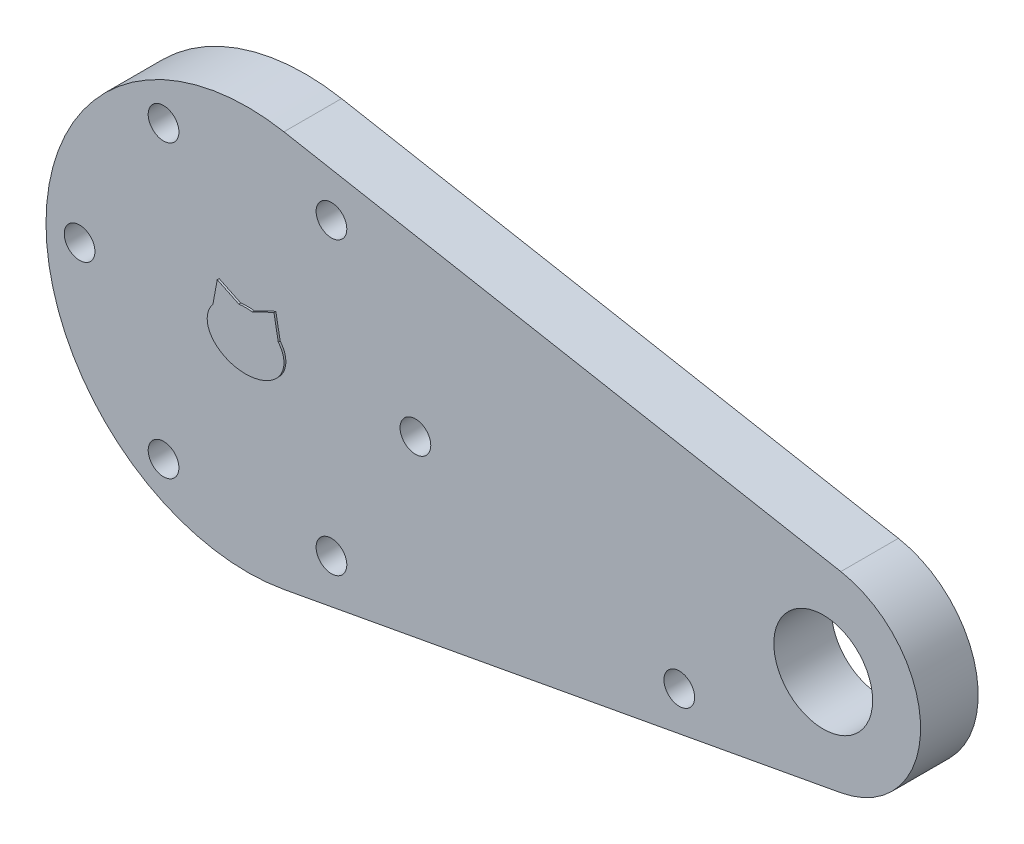
from build123d import *

# Parameters (mm, degrees)
SKETCH_1_R          = 5.15
EXTRUDE_1_DEPTH     = 6
SKETCH_3_R          = 1.6
CUT_EXTRUDE_2_DEPTH = 74.471235868
SKETCH_5_R          = 13.5
EXTRUDE_3_DEPTH     = 0.5
SKETCH_4_R          = 12.35
SKETCH_4_R_2        = 7.65
EXTRUDE_2_DEPTH     = 4
SKETCH_6_R          = 3
CUT_EXTRUDE_3_DEPTH = 3
SKETCH_7_R          = 2.85
CUT_EXTRUDE_4_DEPTH = 3
EXTRUDE_4_DEPTH     = 0.2
SKETCH_10_R         = 1.6
CUT_EXTRUDE_6_DEPTH = 74.487839262


with BuildPart() as part:
    # 草图1 → 凸台-拉伸1 (new body)
    with BuildSketch(Plane.XY):
        with BuildLine():
            Line((61.835458333, -9.98266461), (3.7975, -20.653788847))
            ThreePointArc((3.7975, -20.653788847), (-21, 0), (3.7975, 20.653788847))
            Line((3.7975, 20.653788847), (61.835458333, 9.98266461))
            ThreePointArc((61.835458333, 9.98266461), (70.15, 0), (61.835458333, -9.98266461))
        make_face()
        with Locations((60, 0)):
            Circle(SKETCH_1_R, mode=Mode.SUBTRACT)
    extrude(amount=EXTRUDE_1_DEPTH)

    # 草图3 → 切除-拉伸2 (cut, through all)
    with BuildSketch(Plane.XY.offset(6)):
        with Locations((8.75, 15.155444566)):
            Circle(SKETCH_3_R)
        with Locations((17.5, 0)):
            Circle(SKETCH_3_R)
        with Locations((8.75, -15.155444566)):
            Circle(SKETCH_3_R)
        with Locations((-8.75, -15.155444566)):
            Circle(SKETCH_3_R)
        with Locations((-17.5, 0)):
            Circle(SKETCH_3_R)
        with Locations((-8.75, 15.155444566)):
            Circle(SKETCH_3_R)
    extrude(amount=-CUT_EXTRUDE_2_DEPTH, mode=Mode.SUBTRACT)

    # 草图5 → 凸台-拉伸3 (add)
    with BuildSketch(Plane(origin=(0, 0, 0), x_dir=(-1, 0, 0), z_dir=(0, 0, -1))):
        with Locations(Location((0, 0, 0), (0, 0, 180))):
            Circle(SKETCH_5_R)
    extrude(amount=EXTRUDE_3_DEPTH)

    # 草图4 → 凸台-拉伸2 (add)
    with BuildSketch(Plane(origin=(0, 0, -0.5), x_dir=(-1, 0, 0), z_dir=(0, 0, -1))):
        Circle(SKETCH_4_R)
        Circle(SKETCH_4_R_2, mode=Mode.SUBTRACT)
    extrude(amount=EXTRUDE_2_DEPTH)

    # 草图6 → 切除-拉伸3 (cut)
    with BuildSketch(Plane(origin=(0, 0, -0.5), x_dir=(-1, 0, 0), z_dir=(0, 0, -1))):
        Circle(SKETCH_6_R)
    extrude(amount=-CUT_EXTRUDE_3_DEPTH, mode=Mode.SUBTRACT)

    # 草图7 → 切除-拉伸4 (cut)
    with BuildSketch(Plane(origin=(0, 0, 0), x_dir=(-1, 0, 0), z_dir=(0, 0, -1))):
        with Locations((8.75, 15.155444566)):
            Circle(SKETCH_7_R)
        with Locations((17.5, 0)):
            Circle(SKETCH_7_R)
        with Locations((8.75, -15.155444566)):
            Circle(SKETCH_7_R)
        with Locations((-8.75, -15.155444566)):
            Circle(SKETCH_7_R)
        with Locations((-17.5, 0)):
            Circle(SKETCH_7_R)
        with Locations((-8.75, 15.155444566)):
            Circle(SKETCH_7_R)
    extrude(amount=-CUT_EXTRUDE_4_DEPTH, mode=Mode.SUBTRACT)

    # 草图9 → 凸台-拉伸4 (add)
    with BuildSketch(Plane.XY.offset(6)):
        with BuildLine():
            Line((-2.954769624, 4.033526555), (-3.40491347, 1.574386356))
            add(Edge.make_bspline(
                [(-3.40491347, 1.574386356), (-7.165153372, -3), (0, -3), (7.165153372, -3), (3.40491347, 1.574386356)],
                knots=[2.589117856, 2.589117856, 2.589117856, 4.71238898, 4.71238898, 6.835660105, 6.835660105, 6.835660105], degree=2, weights=[1, 0.487444637, 1, 0.487444637, 1]))
            Line((3.40491347, 1.574386356), (2.954769624, 4.033526555))
            Line((2.954769624, 4.033526555), (0.7, 2.9537053))
            add(Edge.make_bspline(
                [(0.7, 2.9537053), (0, 3.047020297), (-0.7, 2.9537053)],
                knots=[1.394890559, 1.394890559, 1.394890559, 1.746702095, 1.746702095, 1.746702095], degree=2, weights=[1, 0.984568433, 1]))
            Line((-0.7, 2.9537053), (-2.954769624, 4.033526555))
        make_face()
    extrude(amount=EXTRUDE_4_DEPTH)

    # 草图10 → 切除-拉伸6 (cut, through all)
    with BuildSketch(Plane(origin=(0, 0, 0), x_dir=(-1, 0, 0), z_dir=(0, 0, -1))):
        with Locations((-45, -9)):
            Circle(SKETCH_10_R)
    extrude(amount=-CUT_EXTRUDE_6_DEPTH, mode=Mode.SUBTRACT)


solid = part.part
